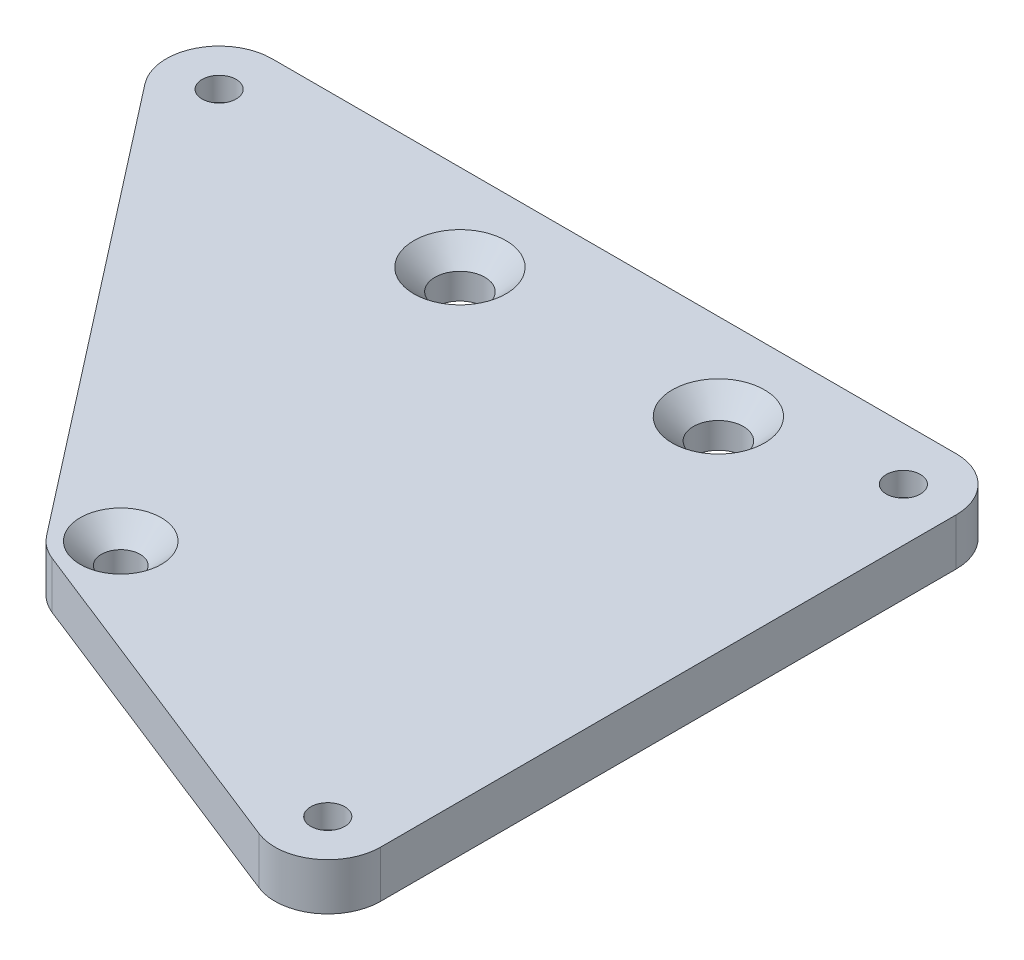
from build123d import *

# Parameters (mm, degrees)
SKETCH1_R           = 3
SKETCH1_R_2         = 1.65
SKETCH1_R_3         = 2.125
BOSS_EXTRUDE1_DEPTH = 4
SKETCH1_3_R         = 3
SKETCH1_3_R_2       = 1.45
BOSS_EXTRUDE2_DEPTH = 2
CHAMFER1_SIZE       = 1.8


with BuildPart() as part:
    # Sketch1 → Boss-Extrude1 (new body)
    with BuildSketch(Plane(origin=(0, 0, 0), x_dir=(1, 0, 0), z_dir=(0, 1, 0))):
        with BuildLine():
            ThreePointArc((-29.125, 29), (-33.166733686, 26.478481442), (-32.678997817, 21.739728362))
            Line((-32.678997817, 21.739728362), (-3.553997817, -15.760271638))
            ThreePointArc((-3.553997817, -15.760271638), (-2.699104035, -16.600671799), (-1.652658398, -17.185537029))
            Line((-1.652658398, -17.185537029), (27.472341602, -28.685537029))
            ThreePointArc((27.472341602, -28.685537029), (31.656110153, -28.22068292), (33.625, -24.5))
            Line((33.625, -24.5), (33.625, 24.5))
            ThreePointArc((33.625, 24.5), (32.306980515, 27.681980515), (29.125, 29))
            Line((29.125, 29), (-29.125, 29))
        make_face()
        with Locations((29.125, -24.5)):
            Circle(SKETCH1_R, mode=Mode.SUBTRACT)
        with Locations((0, -13)):
            Circle(SKETCH1_R_2, mode=Mode.SUBTRACT)
        with Locations((-29.125, 24.5)):
            Circle(SKETCH1_R, mode=Mode.SUBTRACT)
        with Locations((-5.75, 21.625)):
            Circle(SKETCH1_R_3, mode=Mode.SUBTRACT)
        with Locations((16.25, 21.625)):
            Circle(SKETCH1_R_3, mode=Mode.SUBTRACT)
        with Locations((29.125, 24.5)):
            Circle(SKETCH1_R, mode=Mode.SUBTRACT)
    extrude(amount=-BOSS_EXTRUDE1_DEPTH)

    # Sketch1<3> → Boss-Extrude2 (add)
    # profile 1 of 3: a face of its own
    with BuildSketch(Plane(origin=(0, 0, 0), x_dir=(1, 0, 0), z_dir=(0, 1, 0))):
        with Locations((29.125, -24.5)):
            Circle(SKETCH1_3_R)
        with Locations((29.125, -24.5)):
            Circle(SKETCH1_3_R_2, mode=Mode.SUBTRACT)
    # profile 2 of 3: a face of its own
    with BuildSketch(Plane(origin=(0, 0, 0), x_dir=(1, 0, 0), z_dir=(0, 1, 0))):
        with Locations((-29.125, 24.5)):
            Circle(SKETCH1_3_R)
        with Locations((-29.125, 24.5)):
            Circle(SKETCH1_3_R_2, mode=Mode.SUBTRACT)
    # profile 3 of 3: a face of its own
    with BuildSketch(Plane(origin=(0, 0, 0), x_dir=(1, 0, 0), z_dir=(0, 1, 0))):
        with Locations((29.125, 24.5)):
            Circle(SKETCH1_3_R)
        with Locations((29.125, 24.5)):
            Circle(SKETCH1_3_R_2, mode=Mode.SUBTRACT)
    extrude(amount=-BOSS_EXTRUDE2_DEPTH)

    # Chamfer1
    chamfer1_edges = [part.edges().sort_by_distance(p)[0] for p in [
        (-7.875, 0, -21.625),
        (14.125, 0, -21.625),
        (-1.65, 0, 13),
    ]]
    chamfer(chamfer1_edges, length=CHAMFER1_SIZE)


solid = part.part
